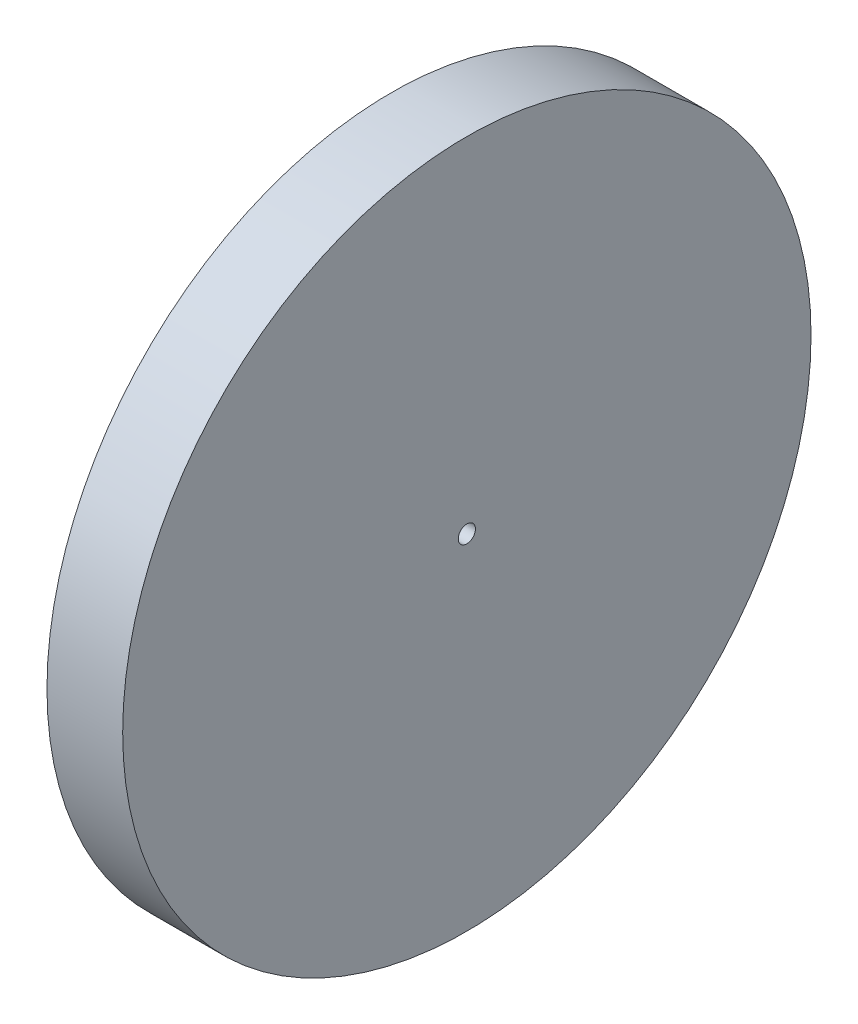
from build123d import *

# Parameters (mm, degrees)
ESQUISSE4_R             = 100
BOSS_EXTRU_2_DEPTH      = 22
ESQUISSE6_R             = 2.5
ENL_V_MAT_EXTRU_1_DEPTH = 22


with BuildPart() as part:
    # Esquisse4 → Boss.-Extru.2 (new body)
    with BuildSketch(Plane(origin=(0, 0, 0), x_dir=(0, 0, -1), z_dir=(1, 0, 0))):
        Circle(ESQUISSE4_R)
    extrude(amount=BOSS_EXTRU_2_DEPTH)

    # Esquisse6 → Enlèv. mat.-Extru.1 (cut)
    with BuildSketch(Plane(origin=(22, 0, 0), x_dir=(0, 0, -1), z_dir=(1, 0, 0))):
        Circle(ESQUISSE6_R)
    extrude(amount=-ENL_V_MAT_EXTRU_1_DEPTH, mode=Mode.SUBTRACT)


solid = part.part
